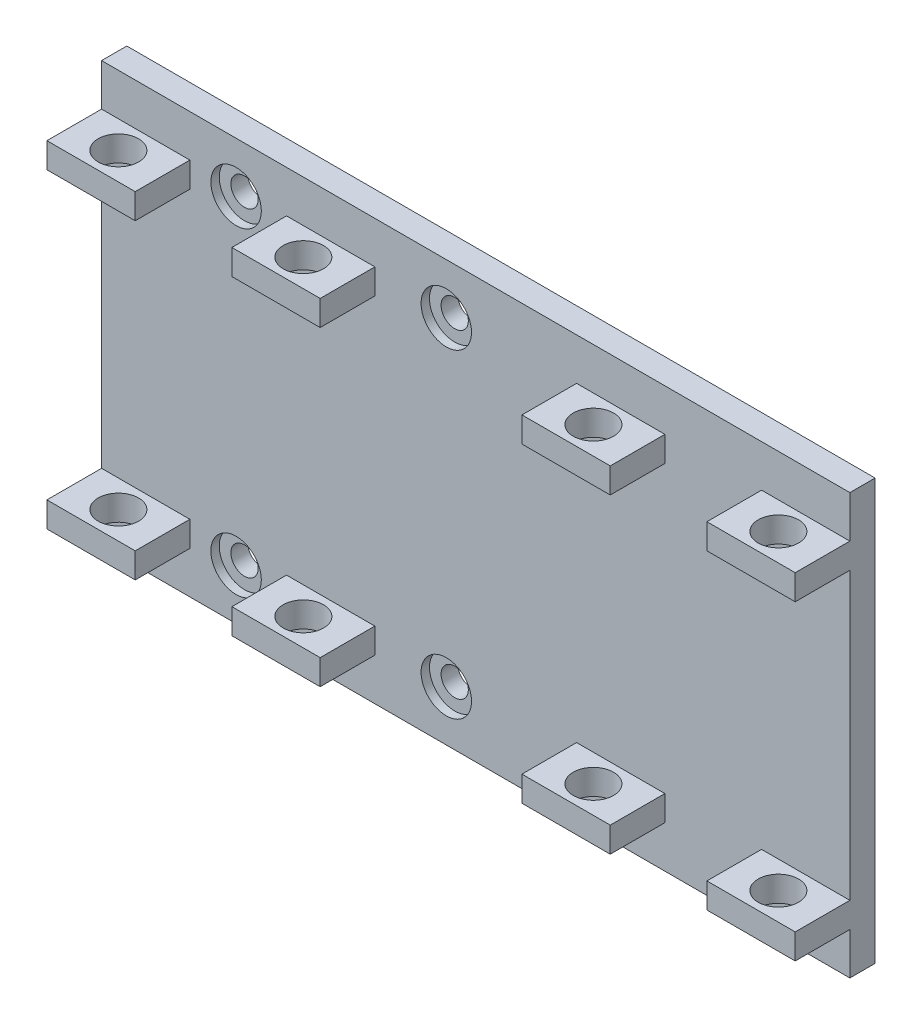
from build123d import *

# Parameters (mm, degrees)
SKETCH_1_W          = 89
SKETCH_1_H          = 40
EXTRUDE_1_DEPTH     = 3
SKETCH_2_W          = 32.5
SKETCH_2_H          = 3
EXTRUDE_2_DEPTH     = 6.5
SKETCH_3_R          = 2.4
CUT_EXTRUDE_1_DEPTH = 100
SKETCH_5_W          = 3
SKETCH_5_H          = 5
EXTRUDE_3_DEPTH     = 89
SKETCH_7_W          = 11.5
SKETCH_7_H          = 50
CUT_EXTRUDE_2_DEPTH = 6.5
SKETCH_8_R          = 1.62
CUT_EXTRUDE_3_DEPTH = 127.662192681
SKETCH_9_R          = 3
CUT_EXTRUDE_4_DEPTH = 1


with BuildPart() as part:
    # 草图1 → 凸台-拉伸1 (new body)
    with BuildSketch(Plane.XY):
        with Locations((-72.64664311, 22.219964664)):
            Rectangle(SKETCH_1_W, SKETCH_1_H)
    extrude(amount=EXTRUDE_1_DEPTH)

    # 草图2 → 凸台-拉伸2 (add)
    with BuildSketch(Plane.XY.offset(3)):
        with Locations((-100.89664311, 40.719964664)):
            Rectangle(SKETCH_2_W, SKETCH_2_H)
        with Locations((-100.89664311, 3.719964664)):
            Rectangle(SKETCH_2_W, SKETCH_2_H)
        with Locations((-44.39664311, 40.719964664)):
            Rectangle(SKETCH_2_W, SKETCH_2_H)
        with Locations((-44.39664311, 3.719964664)):
            Rectangle(SKETCH_2_W, SKETCH_2_H)
    extrude(amount=EXTRUDE_2_DEPTH)

    # 草图3 → 切除-拉伸1 (cut)
    with BuildSketch(Plane(origin=(0, 2.219964664, 0), x_dir=(-1, 0, 0), z_dir=(0, -1, 0))):
        with Locations(Location((111.89664311, -6.25, 0), (0, 0, 90))):
            Circle(SKETCH_3_R)
        with Locations(Location((89.89664311, -6.25, 0), (0, 0, 90))):
            Circle(SKETCH_3_R)
        with Locations(Location((55.39664311, -6.25, 0), (0, 0, 90))):
            Circle(SKETCH_3_R)
        with Locations(Location((33.39664311, -6.25, 0), (0, 0, 90))):
            Circle(SKETCH_3_R)
    extrude(amount=-CUT_EXTRUDE_1_DEPTH, mode=Mode.SUBTRACT)

    # 草图5 → 凸台-拉伸3 (add)
    with BuildSketch(Plane.ZY.offset(117.14664311)):
        with Locations((1.5, 44.719964664)):
            Rectangle(SKETCH_5_W, SKETCH_5_H)
        with Locations((1.5, -0.280035336)):
            Rectangle(SKETCH_5_W, SKETCH_5_H)
    extrude(amount=-EXTRUDE_3_DEPTH)

    # 草图7 → 切除-拉伸2 (cut)
    with BuildSketch(Plane.XY.offset(9.5)):
        with Locations((-100.89664311, 22.219964664)):
            Rectangle(SKETCH_7_W, SKETCH_7_H)
        with Locations((-44.39664311, 22.219964664)):
            Rectangle(SKETCH_7_W, SKETCH_7_H)
    extrude(amount=-CUT_EXTRUDE_2_DEPTH, mode=Mode.SUBTRACT)

    # 草图8 → 切除-拉伸3 (cut, through all)
    with BuildSketch(Plane(origin=(0, 0, 0), x_dir=(-1, 0, 0), z_dir=(0, 0, -1))):
        with Locations((101.14664311, 41.219964664)):
            Circle(SKETCH_8_R)
        with Locations((101.14664311, 3.219964664)):
            Circle(SKETCH_8_R)
        with Locations((76.14664311, 41.219964664)):
            Circle(SKETCH_8_R)
        with Locations((76.14664311, 3.219964664)):
            Circle(SKETCH_8_R)
    extrude(amount=-CUT_EXTRUDE_3_DEPTH, mode=Mode.SUBTRACT)

    # 草图9 → 切除-拉伸4 (cut)
    with BuildSketch(Plane.XY.offset(3)):
        with Locations((-76.14664311, 41.219964664)):
            Circle(SKETCH_9_R)
        with Locations((-101.14664311, 41.219964664)):
            Circle(SKETCH_9_R)
        with Locations((-101.14664311, 3.219964664)):
            Circle(SKETCH_9_R)
        with Locations((-76.14664311, 3.219964664)):
            Circle(SKETCH_9_R)
    extrude(amount=-CUT_EXTRUDE_4_DEPTH, mode=Mode.SUBTRACT)


solid = part.part
